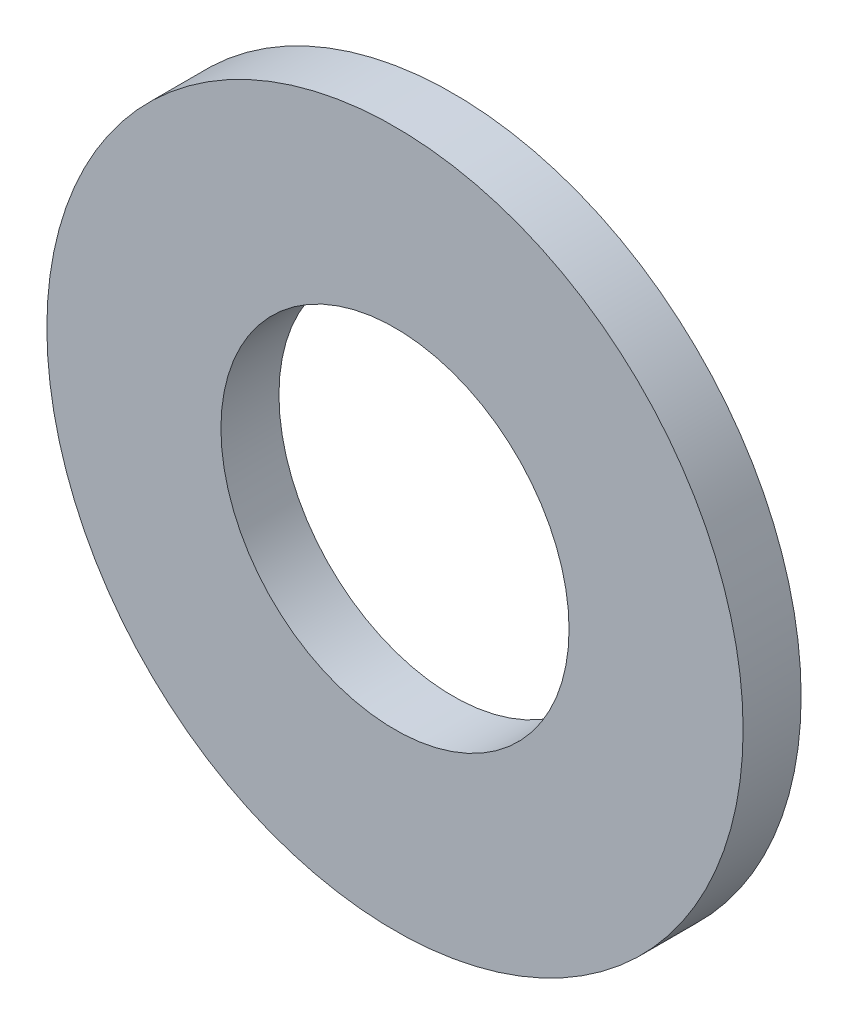
from build123d import *

# Parameters (mm, degrees)
ESQUISSE1_R        = 3
ESQUISSE1_R_2      = 1.5
BOSS_EXTRU_1_DEPTH = 0.5


with BuildPart() as part:
    # Esquisse1 → Boss.-Extru.1 (new body)
    with BuildSketch(Plane.XY):
        Circle(ESQUISSE1_R)
        Circle(ESQUISSE1_R_2, mode=Mode.SUBTRACT)
    extrude(amount=BOSS_EXTRU_1_DEPTH)


solid = part.part
